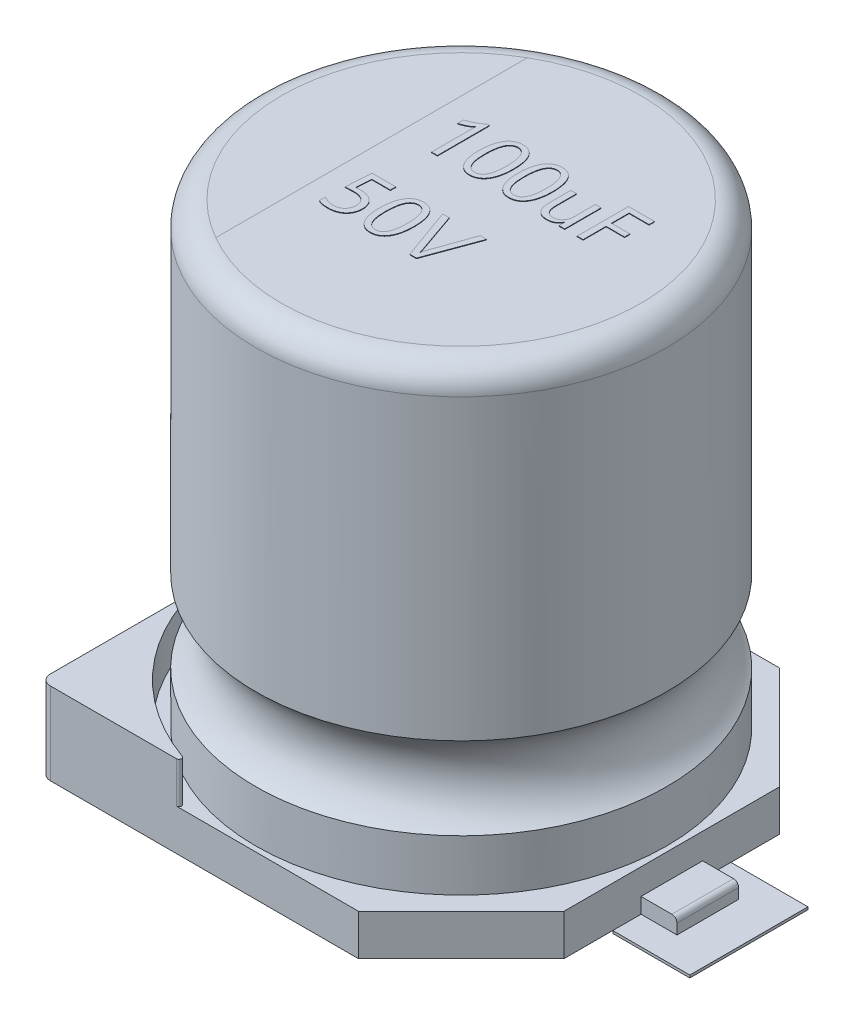
from build123d import *

# Parameters (mm, degrees)
SKETCH1_R             = 4
BOSS_EXTRUDE1_DEPTH   = 8.9
FILLET1_R             = 0.5
SKETCH3_W             = 8.2
SKETCH3_H             = 8.2
BOSS_EXTRUDE2_DEPTH   = 0.8
CHAMFER1_SIZE         = 2
BOSS_EXTRUDE3_DEPTH   = 0.8
FILLET2_R             = 0.05
SKETCH5_W             = 1.2
SKETCH5_H             = 0.3
BOSS_EXTRUDE4_DEPTH   = 0.7
FILLET3_R             = 0.1
FILLET4_R             = 0.2
BOSS_EXTRUDE5_DEPTH   = 0.01
SKETCH8_W             = 1.5
SKETCH8_H             = 2.3
BOSS_EXTRUDE6_DEPTH   = 0.05
BOSS_EXTRUDE6_2_DEPTH = 0.05


with BuildPart() as part:
    # Sketch1 → Boss-Extrude1 (new body)
    with BuildSketch(Plane(origin=(0, 0, 0), x_dir=(1, 0, 0), z_dir=(0, 1, 0))):
        with Locations(Location((0, 0, 0), (0, 0, 270))):
            Circle(SKETCH1_R)
    extrude(amount=BOSS_EXTRUDE1_DEPTH)

    # Sketch2 → Cut-Revolve1 (revolve, cut)
    with BuildSketch(Plane.XY, mode=Mode.PRIVATE) as cut_revolve1_sk:
        with BuildLine():
            Line((-4, 2.6), (-4, 1))
            ThreePointArc((-4, 1), (-3.6, 1.8), (-4, 2.6))
        make_face()
    revolve(cut_revolve1_sk.sketch.rotate(Axis((0, 0, 0), (0, 1, 0)), 270), axis=Axis((0, 0, 0), (0, 1, 0)), mode=Mode.SUBTRACT)

    # Fillet1
    fillet1_edges = [part.edges().sort_by_distance(p)[0] for p in [
        (0, 8.9, -4),
    ]]
    fillet(fillet1_edges, radius=FILLET1_R)

    # Sketch7 → Boss-Extrude5 (add)
    # profile 1 of 8: a face of its own
    with BuildSketch(Plane(origin=(0, 8.9, 0), x_dir=(1, 0, 0), z_dir=(0, 1, 0))):
        with BuildLine():
            Line((-0.963431723, 0.500188603), (-1.07732975, 0.500188603))
            Line((-1.07732975, 0.500188603), (-1.07732975, 1.355040577))
            add(Edge.make_bspline(
                [(-1.07732975, 1.355040577), (-1.079777093, 1.352756928), (-1.085034792, 1.3478509), (-1.09387705, 1.340498161), (-1.104208441, 1.332640753), (-1.12049976, 1.321512017), (-1.14335142, 1.307312876), (-1.173085751, 1.290498318), (-1.20548104, 1.274747136), (-1.239040454, 1.259578397), (-1.273144639, 1.246529775), (-1.296298393, 1.240145156), (-1.307592907, 1.237030708)],
                knots=[0, 0, 0, 0, 0.385015468, 0.827139693, 1.322250538, 1.877706807, 3.096125656, 4.416274777, 5.805430079, 7.238282366, 8.652820666, 10, 10, 10, 10], degree=3))
            Line((-1.307592907, 1.237030708), (-1.307592907, 1.352162287))
            add(Edge.make_bspline(
                [(-1.307592907, 1.352162287), (-1.294653334, 1.35610978), (-1.267783898, 1.364306875), (-1.227473316, 1.380221553), (-1.186459456, 1.398993626), (-1.14575269, 1.419805536), (-1.106604769, 1.442327949), (-1.069663837, 1.465477943), (-1.036198144, 1.488813595), (-1.016101286, 1.505474617), (-1.006606065, 1.513346498)],
                knots=[0, 0, 0, 0, 0.94458981, 1.961470684, 3.023913207, 4.09427277, 5.153432408, 6.177318749, 7.138832524, 8, 8, 8, 8], degree=3))
            Line((-1.006606065, 1.513346498), (-0.963431723, 1.513346498))
            Line((-0.963431723, 1.513346498), (-0.963431723, 0.500188603))
        make_face()
    # profile 2 of 8: a face of its own
    with BuildSketch(Plane(origin=(0, 8.9, 0), x_dir=(1, 0, 0), z_dir=(0, 1, 0))):
        with BuildLine():
            add(Edge.make_bspline(
                [(0.005112685, 1.004711629), (0.004826131, 0.984557566), (0.004268968, 0.945370772), (0.00026028, 0.888304877), (-0.00697127, 0.834774088), (-0.01670279, 0.78474756), (-0.029197763, 0.738431643), (-0.044185511, 0.695758481), (-0.061768763, 0.65682236), (-0.081983566, 0.621736309), (-0.104311728, 0.590281443), (-0.129707187, 0.563262978), (-0.157079658, 0.539685765), (-0.187165811, 0.520517467), (-0.219425585, 0.505217818), (-0.254139435, 0.495007822), (-0.29072768, 0.488007663), (-0.315919286, 0.487360705), (-0.328768894, 0.487030708)],
                knots=[0, 0, 0, 0, 1.398980466, 2.720124312, 3.96812368, 5.146432578, 6.255415985, 7.295087503, 8.282879546, 9.216336252, 10.102253837, 10.953825877, 11.784043498, 12.603506409, 13.42284504, 14.253498671, 15.109153359, 16, 16, 16, 16], degree=3))
            add(Edge.make_bspline(
                [(-0.328768894, 0.487030708), (-0.340926926, 0.487403858), (-0.36472116, 0.488134142), (-0.399403608, 0.494513325), (-0.432131855, 0.504747043), (-0.462749696, 0.519260787), (-0.491170149, 0.537718507), (-0.517128174, 0.560078852), (-0.540797909, 0.586154425), (-0.562204288, 0.615858168), (-0.581056959, 0.649361911), (-0.597559877, 0.686395783), (-0.611358843, 0.727057537), (-0.623154052, 0.771117384), (-0.632024842, 0.818768253), (-0.638552103, 0.869693802), (-0.642510507, 0.923988105), (-0.642912284, 0.961256343), (-0.643119223, 0.980451761)],
                knots=[0, 0, 0, 0, 0.888155269, 1.738190458, 2.568434008, 3.38864091, 4.207101744, 5.03849325, 5.886044594, 6.7759361, 7.709272942, 8.69152049, 9.735599895, 10.845083744, 12.023162705, 13.27590253, 14.596923554, 16, 16, 16, 16], degree=3))
            add(Edge.make_bspline(
                [(-0.643119223, 0.980451761), (-0.642843557, 1.001497645), (-0.642307836, 1.042397677), (-0.638162264, 1.101825233), (-0.631477783, 1.157428823), (-0.622151233, 1.20925434), (-0.609844107, 1.257126333), (-0.595126484, 1.301093022), (-0.577891285, 1.341086758), (-0.557950963, 1.376997022), (-0.535517212, 1.40900922), (-0.510275956, 1.436746934), (-0.482599403, 1.460461121), (-0.452195954, 1.479788402), (-0.419394292, 1.49483533), (-0.384192765, 1.505504416), (-0.346852143, 1.512337738), (-0.321123895, 1.513005818), (-0.308004092, 1.513346498)],
                knots=[0, 0, 0, 0, 1.426258677, 2.771754592, 4.035124818, 5.220331935, 6.337825632, 7.382114204, 8.359741748, 9.284994213, 10.161296122, 11.002979272, 11.820109764, 12.624106341, 13.436709906, 14.257961594, 15.111668944, 16, 16, 16, 16], degree=3))
            add(Edge.make_bspline(
                [(-0.308004092, 1.513346498), (-0.295368868, 1.512959369), (-0.270705783, 1.512203721), (-0.23495184, 1.506094994), (-0.201540462, 1.496387059), (-0.170760666, 1.482139609), (-0.14236875, 1.464156343), (-0.116378867, 1.442121729), (-0.09317833, 1.415950319), (-0.072122691, 1.3860259), (-0.054102459, 1.351883719), (-0.03785807, 1.31408476), (-0.024755916, 1.272056949), (-0.013614383, 1.226276634), (-0.005386797, 1.176431001), (0.000747166, 1.12277945), (0.004461983, 1.065070853), (0.004890986, 1.025276442), (0.005112685, 1.004711629)],
                knots=[0, 0, 0, 0, 0.899241396, 1.755257189, 2.575108327, 3.369931066, 4.161902333, 4.96169813, 5.78762661, 6.645962214, 7.56082504, 8.531597655, 9.571777694, 10.691464586, 11.88443752, 13.166498411, 14.535713275, 16, 16, 16, 16], degree=3))
        make_face()
        with BuildLine():
            add(Edge.make_bspline(
                [(-0.111458039, 0.993198471), (-0.111635005, 1.010469562), (-0.111977861, 1.043930687), (-0.114064832, 1.092507874), (-0.118353658, 1.137667761), (-0.12339049, 1.179587018), (-0.13070288, 1.218050581), (-0.139128469, 1.253280964), (-0.149453536, 1.285169971), (-0.161197046, 1.313719893), (-0.174667974, 1.338955551), (-0.189638832, 1.360931968), (-0.206310236, 1.379614653), (-0.224648836, 1.394887973), (-0.244573932, 1.406866101), (-0.266277141, 1.414960968), (-0.289367294, 1.420441518), (-0.305366891, 1.42097051), (-0.313555079, 1.421241235)],
                knots=[0, 0, 0, 0, 1.581181307, 3.063391078, 4.449305256, 5.73327765, 6.92683892, 8.031533681, 9.047337031, 9.992258722, 10.853979057, 11.661441156, 12.421081853, 13.138403699, 13.838846326, 14.537910874, 15.251739941, 16, 16, 16, 16], degree=3))
            add(Edge.make_bspline(
                [(-0.313555079, 1.421241235), (-0.322149139, 1.420956637), (-0.339019139, 1.420397978), (-0.363407175, 1.415083426), (-0.386204613, 1.406638965), (-0.407231815, 1.394518687), (-0.426456861, 1.378867186), (-0.444102981, 1.359920592), (-0.459894199, 1.337502337), (-0.474045623, 1.311820005), (-0.486699712, 1.28281579), (-0.497086535, 1.250213365), (-0.506460167, 1.214429829), (-0.513622413, 1.175157744), (-0.519677256, 1.132653105), (-0.523608913, 1.086666414), (-0.526124054, 1.037292279), (-0.52640388, 1.003207366), (-0.5265485, 0.985591563)],
                knots=[0, 0, 0, 0, 0.764995805, 1.501674303, 2.212925961, 2.924256282, 3.65393935, 4.414460527, 5.224546987, 6.091227052, 7.023912083, 8.039810551, 9.137474513, 10.318540051, 11.595133009, 12.962565651, 14.430189818, 16, 16, 16, 16], degree=3))
            add(Edge.make_bspline(
                [(-0.5265485, 0.985591563), (-0.526402041, 0.969209241), (-0.526118139, 0.937452912), (-0.523614364, 0.891364271), (-0.519634554, 0.848405362), (-0.513809401, 0.808633363), (-0.506874679, 0.771954437), (-0.497741057, 0.738621381), (-0.487380411, 0.708264032), (-0.475039657, 0.681192385), (-0.461392387, 0.656982181), (-0.445580087, 0.636351776), (-0.428514073, 0.618478865), (-0.409363524, 0.604260881), (-0.388775468, 0.592951387), (-0.366538931, 0.58487104), (-0.342611158, 0.580072872), (-0.326118398, 0.579453407), (-0.317666921, 0.579135971)],
                knots=[0, 0, 0, 0, 1.543513286, 2.992024866, 4.347767877, 5.607075833, 6.778486024, 7.862468221, 8.861099137, 9.797386861, 10.662401359, 11.473455982, 12.240599663, 12.983190345, 13.711379138, 14.446775782, 15.204072658, 16, 16, 16, 16], degree=3))
            add(Edge.make_bspline(
                [(-0.317666921, 0.579135971), (-0.309354713, 0.579462603), (-0.293070777, 0.580102486), (-0.269360779, 0.584815964), (-0.247382033, 0.593201099), (-0.226927748, 0.604593384), (-0.208308613, 0.619420262), (-0.191318052, 0.637397511), (-0.175736559, 0.658496883), (-0.162459537, 0.683184252), (-0.150125444, 0.710733256), (-0.13984854, 0.741627939), (-0.130992629, 0.77569519), (-0.123969588, 0.813015594), (-0.118126249, 0.85347046), (-0.114459312, 0.897202574), (-0.111866128, 0.944099177), (-0.111597053, 0.976472965), (-0.111458039, 0.993198471)],
                knots=[0, 0, 0, 0, 0.775360401, 1.518961016, 2.243373551, 2.96192122, 3.694889719, 4.454670758, 5.264184671, 6.134259122, 7.064577354, 8.077594077, 9.167837551, 10.346585987, 11.618858978, 12.979815247, 14.439659868, 16, 16, 16, 16], degree=3))
        make_face(mode=Mode.SUBTRACT)
    # profile 3 of 8: a face of its own
    with BuildSketch(Plane(origin=(0, 8.9, 0), x_dir=(1, 0, 0), z_dir=(0, 1, 0))):
        with BuildLine():
            add(Edge.make_bspline(
                [(0.768270579, 1.004711629), (0.767984026, 0.984557566), (0.767426863, 0.945370772), (0.763418175, 0.888304877), (0.756186625, 0.834774088), (0.746455105, 0.78474756), (0.733960132, 0.738431643), (0.718972384, 0.695758481), (0.701389132, 0.65682236), (0.681174329, 0.621736309), (0.658846167, 0.590281443), (0.633450707, 0.563262978), (0.606078237, 0.539685765), (0.575992083, 0.520517467), (0.54373231, 0.505217818), (0.50901846, 0.495007822), (0.472430214, 0.488007663), (0.447238608, 0.487360705), (0.434389, 0.487030708)],
                knots=[0, 0, 0, 0, 1.398980466, 2.720124312, 3.96812368, 5.146432578, 6.255415985, 7.295087503, 8.282879546, 9.216336252, 10.102253837, 10.953825877, 11.784043498, 12.603506409, 13.42284504, 14.253498671, 15.109153359, 16, 16, 16, 16], degree=3))
            add(Edge.make_bspline(
                [(0.434389, 0.487030708), (0.422230969, 0.487403858), (0.398436735, 0.488134142), (0.363754287, 0.494513325), (0.331026039, 0.504747043), (0.300408199, 0.519260787), (0.271987746, 0.537718507), (0.246029721, 0.560078852), (0.222359986, 0.586154425), (0.200953607, 0.615858168), (0.182100935, 0.649361911), (0.165598018, 0.686395783), (0.151799052, 0.727057537), (0.140003843, 0.771117384), (0.131133053, 0.818768253), (0.124605791, 0.869693802), (0.120647388, 0.923988105), (0.120245611, 0.961256343), (0.120038671, 0.980451761)],
                knots=[0, 0, 0, 0, 0.888155269, 1.738190458, 2.568434008, 3.38864091, 4.207101744, 5.03849325, 5.886044594, 6.7759361, 7.709272942, 8.69152049, 9.735599895, 10.845083744, 12.023162705, 13.27590253, 14.596923554, 16, 16, 16, 16], degree=3))
            add(Edge.make_bspline(
                [(0.120038671, 0.980451761), (0.120314337, 1.001497645), (0.120850059, 1.042397677), (0.124995631, 1.101825233), (0.131680111, 1.157428823), (0.141006661, 1.20925434), (0.153313788, 1.257126333), (0.168031411, 1.301093022), (0.18526661, 1.341086758), (0.205206931, 1.376997022), (0.227640682, 1.40900922), (0.252881939, 1.436746934), (0.280558491, 1.460461121), (0.31096194, 1.479788402), (0.343763603, 1.49483533), (0.37896513, 1.505504416), (0.416305751, 1.512337738), (0.442033999, 1.513005818), (0.455153803, 1.513346498)],
                knots=[0, 0, 0, 0, 1.426258677, 2.771754592, 4.035124818, 5.220331935, 6.337825632, 7.382114204, 8.359741748, 9.284994213, 10.161296122, 11.002979272, 11.820109764, 12.624106341, 13.436709906, 14.257961594, 15.111668944, 16, 16, 16, 16], degree=3))
            add(Edge.make_bspline(
                [(0.455153803, 1.513346498), (0.467789027, 1.512959369), (0.492452111, 1.512203721), (0.528206054, 1.506094994), (0.561617433, 1.496387059), (0.592397229, 1.482139609), (0.620789145, 1.464156343), (0.646779028, 1.442121729), (0.669979565, 1.415950319), (0.691035204, 1.3860259), (0.709055435, 1.351883719), (0.725299825, 1.31408476), (0.738401979, 1.272056949), (0.749543511, 1.226276634), (0.757771097, 1.176431001), (0.763905061, 1.12277945), (0.767619878, 1.065070853), (0.768048881, 1.025276442), (0.768270579, 1.004711629)],
                knots=[0, 0, 0, 0, 0.899241396, 1.755257189, 2.575108327, 3.369931066, 4.161902333, 4.96169813, 5.78762661, 6.645962214, 7.56082504, 8.531597655, 9.571777694, 10.691464586, 11.88443752, 13.166498411, 14.535713275, 16, 16, 16, 16], degree=3))
        make_face()
        with BuildLine():
            add(Edge.make_bspline(
                [(0.651699856, 0.993198471), (0.651522889, 1.010469562), (0.651180034, 1.043930687), (0.649093063, 1.092507874), (0.644804237, 1.137667761), (0.639767405, 1.179587018), (0.632455014, 1.218050581), (0.624029426, 1.253280964), (0.613704359, 1.285169971), (0.601960849, 1.313719893), (0.588489921, 1.338955551), (0.573519063, 1.360931968), (0.556847658, 1.379614653), (0.538509059, 1.394887973), (0.518583963, 1.406866101), (0.496880754, 1.414960968), (0.473790601, 1.420441518), (0.457791004, 1.42097051), (0.449602816, 1.421241235)],
                knots=[0, 0, 0, 0, 1.581181307, 3.063391078, 4.449305256, 5.73327765, 6.92683892, 8.031533681, 9.047337031, 9.992258722, 10.853979057, 11.661441156, 12.421081853, 13.138403699, 13.838846326, 14.537910874, 15.251739941, 16, 16, 16, 16], degree=3))
            add(Edge.make_bspline(
                [(0.449602816, 1.421241235), (0.441008756, 1.420956637), (0.424138756, 1.420397978), (0.39975072, 1.415083426), (0.376953282, 1.406638965), (0.35592608, 1.394518687), (0.336701034, 1.378867186), (0.319054913, 1.359920592), (0.303263696, 1.337502337), (0.289112272, 1.311820005), (0.276458182, 1.28281579), (0.26607136, 1.250213365), (0.256697728, 1.214429829), (0.249535481, 1.175157744), (0.243480639, 1.132653105), (0.239548982, 1.086666414), (0.23703384, 1.037292279), (0.236754015, 1.003207366), (0.236609395, 0.985591563)],
                knots=[0, 0, 0, 0, 0.764995805, 1.501674303, 2.212925961, 2.924256282, 3.65393935, 4.414460527, 5.224546987, 6.091227052, 7.023912083, 8.039810551, 9.137474513, 10.318540051, 11.595133009, 12.962565651, 14.430189818, 16, 16, 16, 16], degree=3))
            add(Edge.make_bspline(
                [(0.236609395, 0.985591563), (0.236755854, 0.969209241), (0.237039756, 0.937452912), (0.239543531, 0.891364271), (0.243523341, 0.848405362), (0.249348493, 0.808633363), (0.256283216, 0.771954437), (0.265416837, 0.738621381), (0.275777484, 0.708264032), (0.288118237, 0.681192385), (0.301765507, 0.656982181), (0.317577808, 0.636351776), (0.334643822, 0.618478865), (0.35379437, 0.604260881), (0.374382427, 0.592951387), (0.396618963, 0.58487104), (0.420546736, 0.580072872), (0.437039497, 0.579453407), (0.445490974, 0.579135971)],
                knots=[0, 0, 0, 0, 1.543513286, 2.992024866, 4.347767877, 5.607075833, 6.778486024, 7.862468221, 8.861099137, 9.797386861, 10.662401359, 11.473455982, 12.240599663, 12.983190345, 13.711379138, 14.446775782, 15.204072658, 16, 16, 16, 16], degree=3))
            add(Edge.make_bspline(
                [(0.445490974, 0.579135971), (0.453803181, 0.579462603), (0.470087117, 0.580102486), (0.493797116, 0.584815964), (0.515775862, 0.593201099), (0.536230147, 0.604593384), (0.554849281, 0.619420262), (0.571839842, 0.637397511), (0.587421335, 0.658496883), (0.600698358, 0.683184252), (0.61303245, 0.710733256), (0.623309355, 0.741627939), (0.632165265, 0.77569519), (0.639188306, 0.813015594), (0.645031646, 0.85347046), (0.648698582, 0.897202574), (0.651291767, 0.944099177), (0.651560842, 0.976472965), (0.651699856, 0.993198471)],
                knots=[0, 0, 0, 0, 0.775360401, 1.518961016, 2.243373551, 2.96192122, 3.694889719, 4.454670758, 5.264184671, 6.134259122, 7.064577354, 8.077594077, 9.167837551, 10.346585987, 11.618858978, 12.979815247, 14.439659868, 16, 16, 16, 16], degree=3))
        make_face(mode=Mode.SUBTRACT)
    # profile 4 of 8: a face of its own
    with BuildSketch(Plane(origin=(0, 8.9, 0), x_dir=(1, 0, 0), z_dir=(0, 1, 0))):
        with BuildLine():
            Line((1.513336369, 0.500188603), (1.399438343, 0.500188603))
            Line((1.399438343, 0.500188603), (1.399438343, 0.612441892))
            Line((1.399438343, 0.612441892), (1.396765645, 0.612441892))
            add(Edge.make_bspline(
                [(1.396765645, 0.612441892), (1.390720663, 0.602460299), (1.378922171, 0.5829784), (1.357224617, 0.557406109), (1.333497285, 0.535340747), (1.30679844, 0.517874984), (1.27796377, 0.503876254), (1.246605155, 0.493991312), (1.212766798, 0.488233325), (1.189414343, 0.487439271), (1.177398869, 0.487030708)],
                knots=[0, 0, 0, 0, 1.050691007, 2.050720406, 3.012962404, 3.962401766, 4.915874185, 5.894932476, 6.916885468, 8, 8, 8, 8], degree=3))
            add(Edge.make_bspline(
                [(1.177398869, 0.487030708), (1.167106673, 0.487257871), (1.147213655, 0.487696936), (1.11834269, 0.491353296), (1.091359331, 0.496789144), (1.066537263, 0.505487129), (1.043447569, 0.515877394), (1.022427463, 0.528850187), (1.003437756, 0.544280218), (0.986572548, 0.56212546), (0.971356904, 0.582119485), (0.958722421, 0.604808693), (0.947754222, 0.629646774), (0.938794621, 0.656780083), (0.931760999, 0.68627913), (0.926955997, 0.718120739), (0.92409119, 0.75232886), (0.923696159, 0.775881872), (0.923492619, 0.78801755)],
                knots=[0, 0, 0, 0, 1.09540131, 2.117219514, 3.094696566, 4.020015321, 4.911365501, 5.786165053, 6.642013186, 7.509079247, 8.394916856, 9.30993597, 10.267157936, 11.282441873, 12.347880503, 13.49236844, 14.707944063, 16, 16, 16, 16], degree=3))
            Line((0.923492619, 0.78801755), (0.923492619, 1.210714919))
            Line((0.923492619, 1.210714919), (1.036568277, 1.210714919))
            Line((1.036568277, 1.210714919), (1.036568277, 0.804053735))
            add(Edge.make_bspline(
                [(1.036568277, 0.804053735), (1.036658129, 0.79500285), (1.03683264, 0.777424219), (1.038994686, 0.751898193), (1.042143232, 0.72804247), (1.046826816, 0.705955212), (1.053044542, 0.68569587), (1.060388214, 0.66715835), (1.068975395, 0.650310847), (1.079241694, 0.635355566), (1.090611126, 0.621958112), (1.103608072, 0.610479502), (1.117877537, 0.600820717), (1.133413594, 0.592673278), (1.150370126, 0.586537416), (1.168663857, 0.582288295), (1.188210634, 0.579518344), (1.201717402, 0.57926565), (1.208648869, 0.579135971)],
                knots=[0, 0, 0, 0, 1.343703186, 2.609740898, 3.801442941, 4.915248641, 5.95827345, 6.944754588, 7.873313373, 8.759642607, 9.632786239, 10.476245362, 11.325882859, 12.18618061, 13.074785555, 13.995503533, 14.971323121, 16, 16, 16, 16], degree=3))
            add(Edge.make_bspline(
                [(1.208648869, 0.579135971), (1.215444264, 0.579340895), (1.228822529, 0.579744332), (1.248382544, 0.582703586), (1.267049545, 0.587339775), (1.284654366, 0.594262065), (1.301392063, 0.602948489), (1.317350699, 0.613434023), (1.332147143, 0.626102121), (1.345940795, 0.640486012), (1.358314303, 0.656498858), (1.369603949, 0.673539607), (1.378805849, 0.692024015), (1.38648315, 0.711539654), (1.39212846, 0.732324927), (1.396555207, 0.754141181), (1.398974255, 0.77727204), (1.39928124, 0.793083669), (1.399438343, 0.801175445)],
                knots=[0, 0, 0, 0, 0.99348202, 1.955893163, 2.886897847, 3.800751478, 4.715209456, 5.640858053, 6.586634716, 7.557773505, 8.550193329, 9.542613152, 10.542143211, 11.563936364, 12.604722674, 13.687744657, 14.816677783, 16, 16, 16, 16], degree=3))
            Line((1.399438343, 0.801175445), (1.399438343, 1.210714919))
            Line((1.399438343, 1.210714919), (1.513336369, 1.210714919))
            Line((1.513336369, 1.210714919), (1.513336369, 0.500188603))
        make_face()
    # profile 5 of 8: a face of its own
    with BuildSketch(Plane(origin=(0, 8.9, 0), x_dir=(1, 0, 0), z_dir=(0, 1, 0))):
        Polygon((2.261897224, 1.394925445), (1.873328145, 1.394925445), (1.873328145, 1.052820182), (2.232703145, 1.052820182), (2.232703145, 0.947557024), (1.873328145, 0.947557024), (1.873328145, 0.500188603), (1.756757421, 0.500188603), (1.756757421, 1.500188603), (2.261897224, 1.500188603), align=None)
    # profile 6 of 8: a face of its own
    with BuildSketch(Plane(origin=(0, 8.9, 0), x_dir=(1, 0, 0), z_dir=(0, 1, 0))):
        with BuildLine():
            add(Edge.make_bspline(
                [(-0.793612644, -1.127775788), (-0.793960298, -1.139574748), (-0.794642043, -1.162712395), (-0.799064628, -1.196669956), (-0.807223545, -1.228776685), (-0.818031971, -1.259148157), (-0.831964387, -1.287475253), (-0.84837346, -1.313832799), (-0.867512243, -1.338196132), (-0.889334264, -1.360347166), (-0.913582321, -1.380386349), (-0.94053288, -1.397725884), (-0.969631482, -1.413005561), (-1.001266549, -1.425393112), (-1.034752556, -1.435646199), (-1.070265746, -1.44238049), (-1.107502327, -1.4469306), (-1.132962205, -1.447424321), (-1.145997513, -1.447677104)],
                knots=[0, 0, 0, 0, 1.056864167, 2.072500419, 3.059485391, 4.018613275, 4.954681828, 5.881162702, 6.794724112, 7.723560484, 8.661137091, 9.605998599, 10.588833302, 11.59982216, 12.644532083, 13.720683555, 14.833003331, 16, 16, 16, 16], degree=3))
            add(Edge.make_bspline(
                [(-1.145997513, -1.447677104), (-1.157169676, -1.44755688), (-1.178844942, -1.447323631), (-1.210217715, -1.445589255), (-1.239346016, -1.442162006), (-1.266312612, -1.438066715), (-1.291036625, -1.432285861), (-1.313517302, -1.425324282), (-1.333853616, -1.417259251), (-1.346100363, -1.410454138), (-1.352000802, -1.407175459)],
                knots=[0, 0, 0, 0, 1.263126396, 2.450608766, 3.550077914, 4.578015321, 5.532741343, 6.41739748, 7.237507678, 8, 8, 8, 8], degree=3))
            Line((-1.352000802, -1.407175459), (-1.352000802, -1.289782367))
            add(Edge.make_bspline(
                [(-1.352000802, -1.289782367), (-1.343644519, -1.295047632), (-1.327115968, -1.305462213), (-1.301398701, -1.318689721), (-1.275672137, -1.330073303), (-1.249798347, -1.339444348), (-1.223733025, -1.346605094), (-1.1974887, -1.351776104), (-1.171090993, -1.354979568), (-1.153407625, -1.355374304), (-1.144558368, -1.35557184)],
                knots=[0, 0, 0, 0, 1.073575538, 2.123509434, 3.141212585, 4.131255582, 5.1129617, 6.077547705, 7.037950563, 8, 8, 8, 8], degree=3))
            add(Edge.make_bspline(
                [(-1.144558368, -1.35557184), (-1.13577573, -1.355388981), (-1.118565534, -1.355030654), (-1.09348191, -1.351802344), (-1.069600723, -1.347029456), (-1.047197078, -1.339744061), (-1.026294475, -1.330749682), (-1.00693468, -1.320167604), (-0.989181315, -1.308039635), (-0.973029778, -1.29419492), (-0.958648025, -1.278678747), (-0.94576485, -1.261858724), (-0.93509558, -1.243311522), (-0.926051079, -1.223573267), (-0.918714709, -1.20255171), (-0.914035937, -1.180358364), (-0.910707996, -1.157275006), (-0.910360819, -1.141563111), (-0.910183368, -1.133532367)],
                knots=[0, 0, 0, 0, 1.158660806, 2.270477318, 3.333079092, 4.368579658, 5.373363954, 6.332745853, 7.27608927, 8.206156569, 9.134110276, 10.063957633, 10.99630925, 11.951503368, 12.926911662, 13.927616427, 14.940752784, 16, 16, 16, 16], degree=3))
            add(Edge.make_bspline(
                [(-0.910183368, -1.133532367), (-0.910372696, -1.125504516), (-0.91074311, -1.109798279), (-0.913878157, -1.086857782), (-0.919040275, -1.065263813), (-0.925899626, -1.044864207), (-0.935384798, -1.026114831), (-0.9463914, -1.008384945), (-0.960003861, -0.992409341), (-0.97515884, -0.977427808), (-0.992551618, -0.964366436), (-1.011647661, -0.952710772), (-1.032630564, -0.942803068), (-1.055603774, -0.9351487), (-1.080270122, -0.928920598), (-1.106733846, -0.924473626), (-1.135111939, -0.921743454), (-1.154625896, -0.921491479), (-1.164706394, -0.921361314)],
                knots=[0, 0, 0, 0, 1.024220939, 2.003855773, 2.947861307, 3.855091956, 4.742976808, 5.623725423, 6.511739495, 7.414744547, 8.338353125, 9.280330718, 10.266270024, 11.292393647, 12.365736532, 13.510265708, 14.713855882, 16, 16, 16, 16], degree=3))
            add(Edge.make_bspline(
                [(-1.164706394, -0.921361314), (-1.171560192, -0.921394443), (-1.185681562, -0.921462702), (-1.207193389, -0.922254008), (-1.229272396, -0.922665261), (-1.25139504, -0.923887785), (-1.27327405, -0.924724478), (-1.294443985, -0.926244892), (-1.314396907, -0.92779629), (-1.327195143, -0.929147098), (-1.333291921, -0.92979059)],
                knots=[0, 0, 0, 0, 0.974070636, 2.006947305, 3.059296761, 4.112367188, 5.155707916, 6.170982707, 7.128699404, 8, 8, 8, 8], degree=3))
            Line((-1.333291921, -0.92979059), (-1.299369223, -0.434519209))
            Line((-1.299369223, -0.434519209), (-0.839254092, -0.434519209))
            Line((-0.839254092, -0.434519209), (-0.839254092, -0.539782367))
            Line((-0.839254092, -0.539782367), (-1.200890605, -0.539782367))
            Line((-1.200890605, -0.539782367), (-1.221038631, -0.832751117))
            add(Edge.make_bspline(
                [(-1.221038631, -0.832751117), (-1.213433803, -0.832230981), (-1.197753352, -0.831158508), (-1.174165049, -0.830322134), (-1.151213288, -0.829335855), (-1.13633566, -0.829281563), (-1.129344552, -0.829256051)],
                knots=[0, 0, 0, 0, 0.996597619, 2.054892104, 3.085979286, 4, 4, 4, 4], degree=3))
            add(Edge.make_bspline(
                [(-1.129344552, -0.829256051), (-1.116519915, -0.829471408), (-1.091424837, -0.829892817), (-1.054899457, -0.83379702), (-1.020478392, -0.840447124), (-0.98815701, -0.849354217), (-0.958105906, -0.860993658), (-0.930105297, -0.874409082), (-0.904774709, -0.890581171), (-0.881781042, -0.908719161), (-0.861256526, -0.929021564), (-0.843194455, -0.95146848), (-0.828236963, -0.976424175), (-0.815624804, -1.003198072), (-0.805826391, -1.031899989), (-0.798506648, -1.0622926), (-0.794472337, -1.094497952), (-0.793903264, -1.116526179), (-0.793612644, -1.127775788)],
                knots=[0, 0, 0, 0, 1.209722839, 2.367169476, 3.460249484, 4.51448871, 5.52555128, 6.497162283, 7.438882481, 8.354766373, 9.255461188, 10.15719975, 11.065382765, 11.993869493, 12.944690782, 13.921729643, 14.938646801, 16, 16, 16, 16], degree=3))
        make_face()
    # profile 7 of 8: a face of its own
    with BuildSketch(Plane(origin=(0, 8.9, 0), x_dir=(1, 0, 0), z_dir=(0, 1, 0))):
        with BuildLine():
            add(Edge.make_bspline(
                [(0.005112685, -0.929996183), (0.004826131, -0.950150246), (0.004268968, -0.98933704), (0.00026028, -1.046402935), (-0.00697127, -1.099933724), (-0.01670279, -1.149960252), (-0.029197763, -1.196276169), (-0.044185511, -1.238949331), (-0.061768763, -1.277885452), (-0.081983566, -1.312971503), (-0.104311728, -1.344426369), (-0.129707187, -1.371444834), (-0.157079658, -1.395022046), (-0.187165811, -1.414190345), (-0.219425585, -1.429489994), (-0.254139435, -1.43969999), (-0.29072768, -1.446700149), (-0.315919286, -1.447347107), (-0.328768894, -1.447677104)],
                knots=[0, 0, 0, 0, 1.398980466, 2.720124312, 3.96812368, 5.146432578, 6.255415985, 7.295087503, 8.282879546, 9.216336252, 10.102253837, 10.953825877, 11.784043498, 12.603506409, 13.42284504, 14.253498671, 15.109153359, 16, 16, 16, 16], degree=3))
            add(Edge.make_bspline(
                [(-0.328768894, -1.447677104), (-0.340926926, -1.447303954), (-0.36472116, -1.44657367), (-0.399403608, -1.440194487), (-0.432131855, -1.429960769), (-0.462749696, -1.415447025), (-0.491170149, -1.396989305), (-0.517128174, -1.37462896), (-0.540797909, -1.348553387), (-0.562204288, -1.318849644), (-0.581056959, -1.285345901), (-0.597559877, -1.248312029), (-0.611358843, -1.207650274), (-0.623154052, -1.163590428), (-0.632024842, -1.115939559), (-0.638552103, -1.06501401), (-0.642510507, -1.010719707), (-0.642912284, -0.973451468), (-0.643119223, -0.954256051)],
                knots=[0, 0, 0, 0, 0.888155269, 1.738190458, 2.568434008, 3.38864091, 4.207101744, 5.03849325, 5.886044594, 6.7759361, 7.709272942, 8.69152049, 9.735599895, 10.845083744, 12.023162705, 13.27590253, 14.596923554, 16, 16, 16, 16], degree=3))
            add(Edge.make_bspline(
                [(-0.643119223, -0.954256051), (-0.642843557, -0.933210167), (-0.642307836, -0.892310135), (-0.638162264, -0.832882579), (-0.631477783, -0.777278988), (-0.622151233, -0.725453472), (-0.609844107, -0.677581479), (-0.595126484, -0.63361479), (-0.577891285, -0.593621054), (-0.557950963, -0.55771079), (-0.535517212, -0.525698592), (-0.510275956, -0.497960878), (-0.482599403, -0.47424669), (-0.452195954, -0.45491941), (-0.419394292, -0.439872482), (-0.384192765, -0.429203396), (-0.346852143, -0.422370074), (-0.321123895, -0.421701993), (-0.308004092, -0.421361314)],
                knots=[0, 0, 0, 0, 1.426258677, 2.771754592, 4.035124818, 5.220331935, 6.337825632, 7.382114204, 8.359741748, 9.284994213, 10.161296122, 11.002979272, 11.820109764, 12.624106341, 13.436709906, 14.257961594, 15.111668944, 16, 16, 16, 16], degree=3))
            add(Edge.make_bspline(
                [(-0.308004092, -0.421361314), (-0.295368868, -0.421748443), (-0.270705783, -0.422504091), (-0.23495184, -0.428612818), (-0.201540462, -0.438320753), (-0.170760666, -0.452568203), (-0.14236875, -0.470551469), (-0.116378867, -0.492586082), (-0.09317833, -0.518757492), (-0.072122691, -0.548681912), (-0.054102459, -0.582824092), (-0.03785807, -0.620623051), (-0.024755916, -0.662650863), (-0.013614383, -0.708431178), (-0.005386797, -0.75827681), (0.000747166, -0.811928362), (0.004461983, -0.869636959), (0.004890986, -0.90943137), (0.005112685, -0.929996183)],
                knots=[0, 0, 0, 0, 0.899241396, 1.755257189, 2.575108327, 3.369931066, 4.161902333, 4.96169813, 5.78762661, 6.645962214, 7.56082504, 8.531597655, 9.571777694, 10.691464586, 11.88443752, 13.166498411, 14.535713275, 16, 16, 16, 16], degree=3))
        make_face()
        with BuildLine():
            add(Edge.make_bspline(
                [(-0.111458039, -0.94150934), (-0.111635005, -0.92423825), (-0.111977861, -0.890777124), (-0.114064832, -0.842199937), (-0.118353658, -0.797040051), (-0.12339049, -0.755120794), (-0.13070288, -0.716657231), (-0.139128469, -0.681426848), (-0.149453536, -0.649537841), (-0.161197046, -0.620987919), (-0.174667974, -0.595752261), (-0.189638832, -0.573775843), (-0.206310236, -0.555093158), (-0.224648836, -0.539819839), (-0.244573932, -0.527841711), (-0.266277141, -0.519746844), (-0.289367294, -0.514266294), (-0.305366891, -0.513737302), (-0.313555079, -0.513466577)],
                knots=[0, 0, 0, 0, 1.581181307, 3.063391078, 4.449305256, 5.73327765, 6.92683892, 8.031533681, 9.047337031, 9.992258722, 10.853979057, 11.661441156, 12.421081853, 13.138403699, 13.838846326, 14.537910874, 15.251739941, 16, 16, 16, 16], degree=3))
            add(Edge.make_bspline(
                [(-0.313555079, -0.513466577), (-0.322149139, -0.513751174), (-0.339019139, -0.514309834), (-0.363407175, -0.519624386), (-0.386204613, -0.528068847), (-0.407231815, -0.540189125), (-0.426456861, -0.555840626), (-0.444102981, -0.57478722), (-0.459894199, -0.597205475), (-0.474045623, -0.622887807), (-0.486699712, -0.651892022), (-0.497086535, -0.684494447), (-0.506460167, -0.720277983), (-0.513622413, -0.759550068), (-0.519677256, -0.802054707), (-0.523608913, -0.848041398), (-0.526124054, -0.897415533), (-0.52640388, -0.931500446), (-0.5265485, -0.949116248)],
                knots=[0, 0, 0, 0, 0.764995805, 1.501674303, 2.212925961, 2.924256282, 3.65393935, 4.414460527, 5.224546987, 6.091227052, 7.023912083, 8.039810551, 9.137474513, 10.318540051, 11.595133009, 12.962565651, 14.430189818, 16, 16, 16, 16], degree=3))
            add(Edge.make_bspline(
                [(-0.5265485, -0.949116248), (-0.526402041, -0.965498571), (-0.526118139, -0.9972549), (-0.523614364, -1.043343541), (-0.519634554, -1.08630245), (-0.513809401, -1.126074449), (-0.506874679, -1.162753375), (-0.497741057, -1.196086431), (-0.487380411, -1.22644378), (-0.475039657, -1.253515427), (-0.461392387, -1.277725631), (-0.445580087, -1.298356036), (-0.428514073, -1.316228946), (-0.409363524, -1.330446931), (-0.388775468, -1.341756424), (-0.366538931, -1.349836772), (-0.342611158, -1.35463494), (-0.326118398, -1.355254405), (-0.317666921, -1.35557184)],
                knots=[0, 0, 0, 0, 1.543513286, 2.992024866, 4.347767877, 5.607075833, 6.778486024, 7.862468221, 8.861099137, 9.797386861, 10.662401359, 11.473455982, 12.240599663, 12.983190345, 13.711379138, 14.446775782, 15.204072658, 16, 16, 16, 16], degree=3))
            add(Edge.make_bspline(
                [(-0.317666921, -1.35557184), (-0.309354713, -1.355245209), (-0.293070777, -1.354605326), (-0.269360779, -1.349891848), (-0.247382033, -1.341506713), (-0.226927748, -1.330114428), (-0.208308613, -1.31528755), (-0.191318052, -1.297310301), (-0.175736559, -1.276210929), (-0.162459537, -1.25152356), (-0.150125444, -1.223974556), (-0.13984854, -1.193079873), (-0.130992629, -1.159012622), (-0.123969588, -1.121692217), (-0.118126249, -1.081237352), (-0.114459312, -1.037505238), (-0.111866128, -0.990608635), (-0.111597053, -0.958234847), (-0.111458039, -0.94150934)],
                knots=[0, 0, 0, 0, 0.775360401, 1.518961016, 2.243373551, 2.96192122, 3.694889719, 4.454670758, 5.264184671, 6.134259122, 7.064577354, 8.077594077, 9.167837551, 10.346585987, 11.618858978, 12.979815247, 14.439659868, 16, 16, 16, 16], degree=3))
        make_face(mode=Mode.SUBTRACT)
    # profile 8 of 8: a face of its own
    with BuildSketch(Plane(origin=(0, 8.9, 0), x_dir=(1, 0, 0), z_dir=(0, 1, 0))):
        with BuildLine():
            Line((0.93048275, -0.434519209), (0.562061698, -1.434519209))
            Line((0.562061698, -1.434519209), (0.433772224, -1.434519209))
            Line((0.433772224, -1.434519209), (0.072958079, -0.434519209))
            Line((0.072958079, -0.434519209), (0.202686698, -0.434519209))
            Line((0.202686698, -0.434519209), (0.478180119, -1.227282367))
            add(Edge.make_bspline(
                [(0.478180119, -1.227282367), (0.480292487, -1.233912657), (0.48464027, -1.247559459), (0.490253492, -1.26899756), (0.494618629, -1.291975053), (0.497072805, -1.307798624), (0.498328145, -1.315892564)],
                knots=[0, 0, 0, 0, 0.917522195, 1.888491001, 2.919938635, 4, 4, 4, 4], degree=3))
            Line((0.498328145, -1.315892564), (0.501000843, -1.315892564))
            add(Edge.make_bspline(
                [(0.501000843, -1.315892564), (0.502053286, -1.308743424), (0.504203131, -1.294139758), (0.509683649, -1.272075225), (0.515798621, -1.249046887), (0.521244423, -1.233690261), (0.524027158, -1.225843222)],
                knots=[0, 0, 0, 0, 0.930702889, 1.901162278, 2.927520758, 4, 4, 4, 4], degree=3))
            Line((0.524027158, -1.225843222), (0.804865974, -0.434519209))
            Line((0.804865974, -0.434519209), (0.93048275, -0.434519209))
        make_face()
    extrude(amount=BOSS_EXTRUDE5_DEPTH)


with BuildPart() as body_2:
    # Sketch3 → Boss-Extrude2 (new body)
    with BuildSketch(Plane.XZ):
        Rectangle(SKETCH3_W, SKETCH3_H)
    extrude(amount=BOSS_EXTRUDE2_DEPTH)

    # Chamfer1
    chamfer1_edges = [body_2.edges().sort_by_distance(p)[0] for p in [
        (4.1, -0.4, 4.1),
        (4.1, -0.4, -4.1),
    ]]
    chamfer(chamfer1_edges, length=CHAMFER1_SIZE)

    # Sketch4 → Boss-Extrude3 (add)
    with BuildSketch(Plane(origin=(0, 0, 0), x_dir=(1, 0, 0), z_dir=(0, 1, 0))):
        with BuildLine():
            Line((-1.119151464, -4.1), (-4.1, -4.1))
            Line((-4.1, -4.1), (-4.1, -1.119151464))
            ThreePointArc((-4.1, -1.119151464), (-3.00520382, -3.00520382), (-1.119151464, -4.1))
        make_face()
        with BuildLine():
            Line((-4.1, 4.1), (-1.119151464, 4.1))
            ThreePointArc((-1.119151464, 4.1), (-3.00520382, 3.00520382), (-4.1, 1.119151464))
            Line((-4.1, 1.119151464), (-4.1, 4.1))
        make_face()
    extrude(amount=BOSS_EXTRUDE3_DEPTH)

    # Fillet2
    fillet2_edges = [body_2.edges().sort_by_distance(p)[0] for p in [
        (-4.1, 0.4, -1.119151464),
        (-1.119151464, 0.4, -4.1),
        (-4.1, 0.4, 1.119151464),
        (-1.119151464, 0.4, 4.1),
    ]]
    fillet(fillet2_edges, radius=FILLET2_R)

    # Fillet4
    fillet4_edges = [body_2.edges().sort_by_distance(p)[0] for p in [
        (-4.1, 0, 4.1),
        (-4.1, 0, -4.1),
    ]]
    fillet(fillet4_edges, radius=FILLET4_R)


with BuildPart() as body_3:
    # Sketch5 → Boss-Extrude4 (new body)
    with BuildSketch(Plane.ZY.offset(4.1)):
        with Locations((0, -0.65)):
            Rectangle(SKETCH5_W, SKETCH5_H)
    extrude(amount=BOSS_EXTRUDE4_DEPTH)

    # Fillet3
    fillet3_edges = [body_3.edges().sort_by_distance(p)[0] for p in [
        (-4.8, -0.5, 0),
    ]]
    fillet(fillet3_edges, radius=FILLET3_R)


with BuildPart() as body_4:
    # Mirror3: mirrored copy
    add(body_3.part.mirror(Plane(origin=(0, 0, 0), x_dir=(0, 0, 1), z_dir=(1, 0, 0))))


with BuildPart() as body_5:
    # Sketch8 → Boss-Extrude6 (new body)
    with BuildSketch(Plane.XZ.offset(0.8)):
        with Locations((-4.85, 0)):
            Rectangle(SKETCH8_W, SKETCH8_H)
    extrude(amount=BOSS_EXTRUDE6_DEPTH)


with BuildPart() as body_6:
    # Sketch8 → Boss-Extrude6 2 (new body)
    with BuildSketch(Plane.XZ.offset(0.8)):
        with Locations((4.85, 0)):
            Rectangle(SKETCH8_W, SKETCH8_H)
    extrude(amount=BOSS_EXTRUDE6_2_DEPTH)


solid = Compound([part.part, body_2.part, body_3.part, body_4.part, body_5.part, body_6.part])
